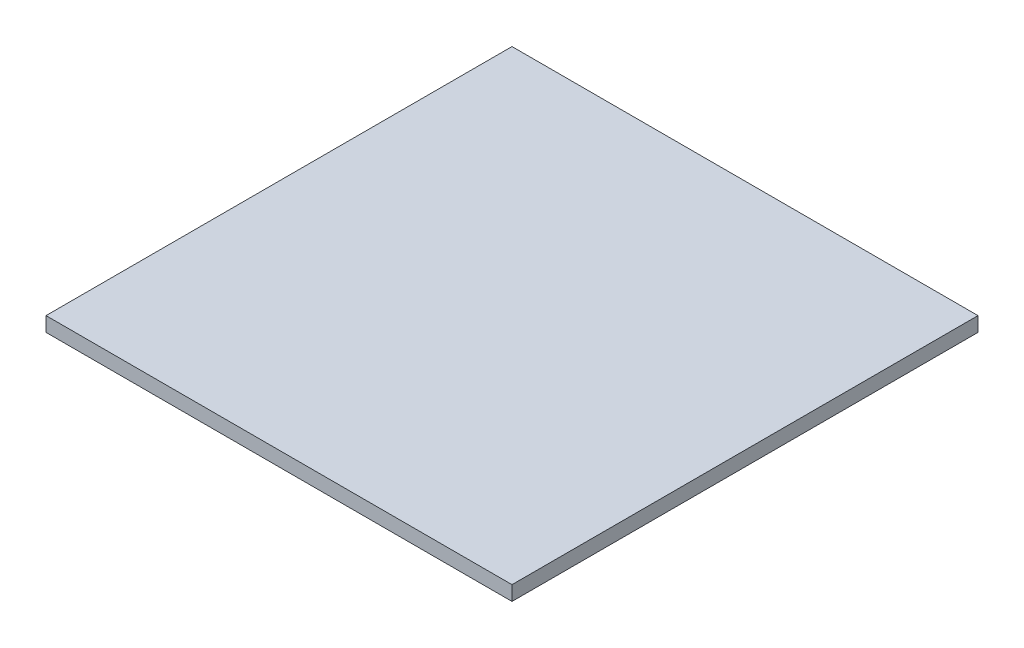
from build123d import *

# Parameters (mm, degrees)
SKETCH3_W           = 203.2
SKETCH3_H           = 6.35
BOSS_EXTRUDE1_DEPTH = 101.6


with BuildPart() as part:
    # Sketch3 → Boss-Extrude1 (new, symmetric)
    with BuildSketch(Plane.XY):
        Rectangle(SKETCH3_W, SKETCH3_H)
    extrude(amount=BOSS_EXTRUDE1_DEPTH, both=True)


solid = part.part
